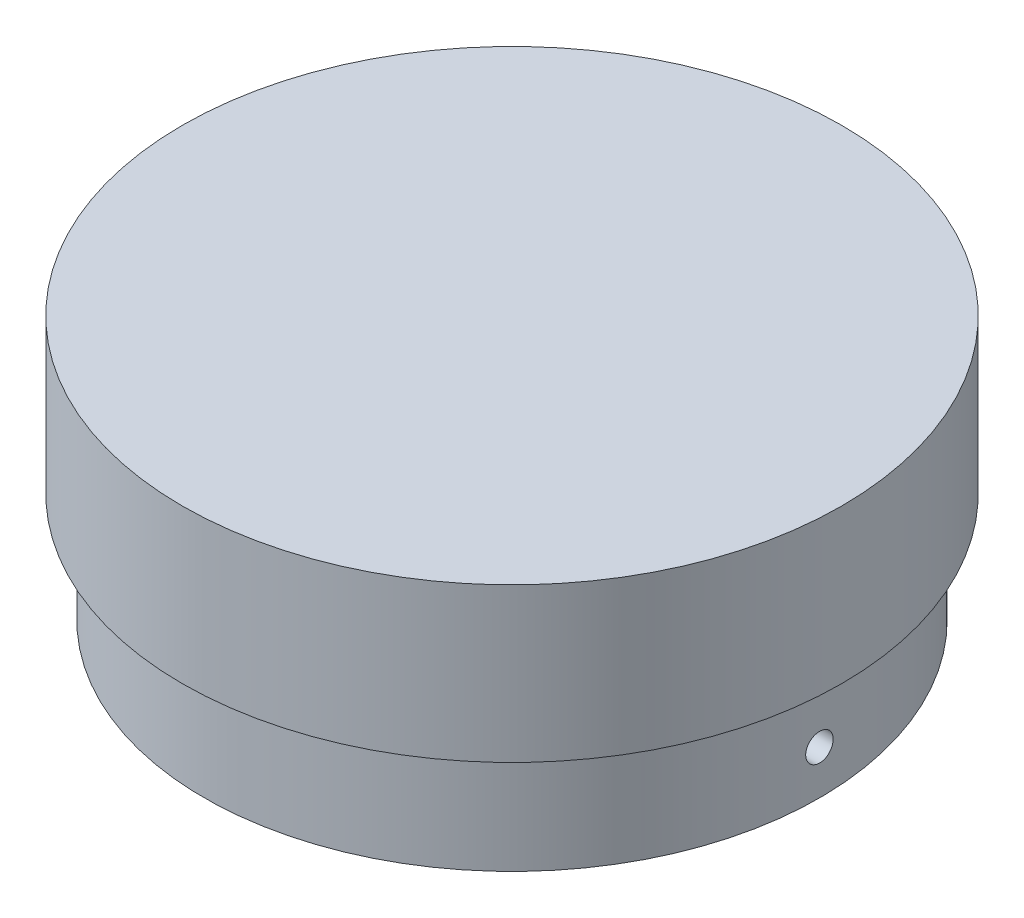
from build123d import *

# Parameters (mm, degrees)
SKETCH3_R          = 3.96875
CUT_EXTRUDE1_DEPTH = 12.7
CIRPATTERN2_COUNT  = 2


with BuildPart() as part:
    # Sketch1 → Revolve1 (revolve)
    with BuildSketch(Plane.XY, mode=Mode.PRIVATE) as revolve1_sk:
        Polygon((0, 0), (88.9, 0), (88.9, 31.75), (95.25, 31.75), (95.25, 76.2), (0, 76.2), align=None)
    revolve(revolve1_sk.sketch.rotate(Axis((0, 0, 0), (0, 1, 0)), 90), axis=Axis((0, 0, 0), (0, 1, 0)))

    # Sketch3 → Cut-Extrude1 (cut)
    with BuildSketch(Plane(origin=(88.9, 0, 0), x_dir=(0, 0, -1), z_dir=(1, 0, 0))):
        with Locations((0, 12.7)):
            Circle(SKETCH3_R)
    cut_extrude1 = extrude(amount=-CUT_EXTRUDE1_DEPTH, mode=Mode.SUBTRACT)

    # CirPattern2: Cut-Extrude1 ×2 about axis
    cirpattern2_axis = Axis((0, 0, 0), (0, -1, 0))
    for i in range(1, CIRPATTERN2_COUNT):
        add(cut_extrude1.rotate(cirpattern2_axis, i * 360 / CIRPATTERN2_COUNT), mode=Mode.SUBTRACT)


solid = part.part
